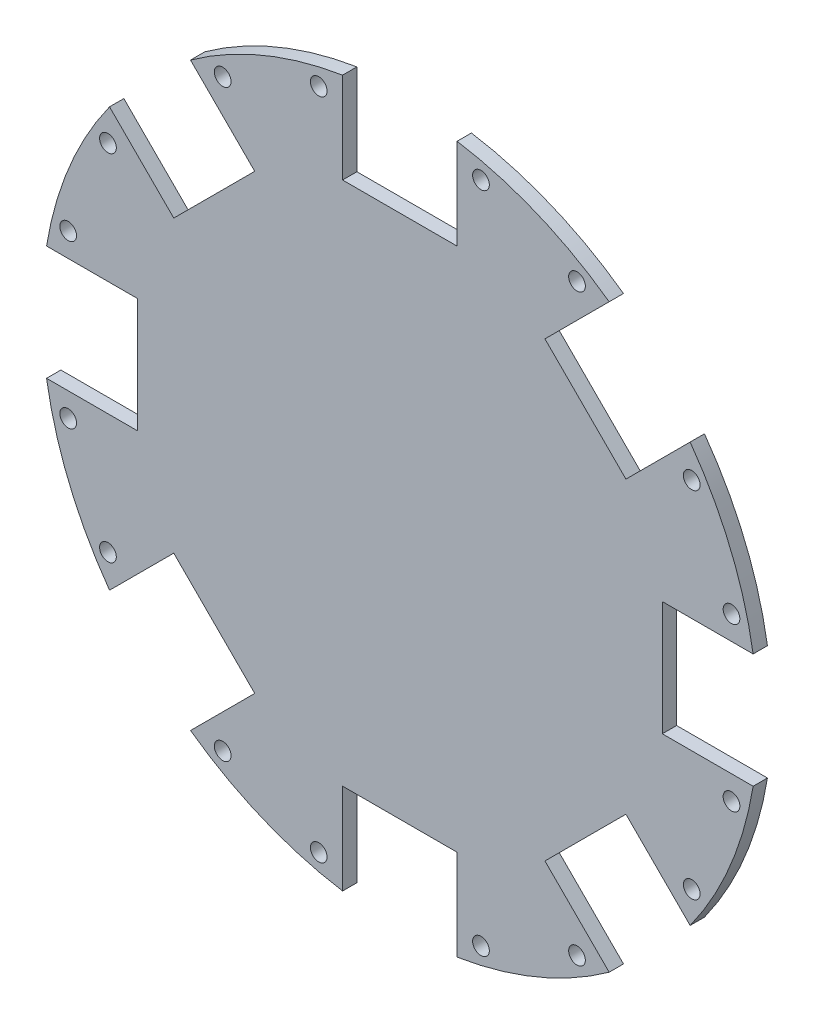
from build123d import *

# Parameters (mm, degrees)
SKETCH1_R           = 1.75
BOSS_EXTRUDE2_DEPTH = 3


with BuildPart() as part:
    # Sketch1 → Boss-Extrude2 (new body)
    with BuildSketch(Plane.XY):
        with BuildLine():
            Line((12, 55), (0, 55))
            Line((0, 55), (-12, 55))
            Line((-12, 55), (-12, 69.5))
            Line((-12, 69.5), (-12, 74.033776076))
            ThreePointArc((-12, 74.033776076), (-28.701257427, 69.290964938), (-43.864503726, 60.835066474))
            Line((-43.864503726, 60.835066474), (-30.405591591, 47.376154339))
            Line((-30.405591591, 47.376154339), (-47.376154339, 30.405591591))
            Line((-47.376154339, 30.405591591), (-60.835066474, 43.864503726))
            ThreePointArc((-60.835066474, 43.864503726), (-69.290964938, 28.701257427), (-74.033776076, 12))
            Line((-74.033776076, 12), (-55, 12))
            Line((-55, 12), (-55, -12))
            Line((-55, -12), (-74.033776076, -12))
            ThreePointArc((-74.033776076, -12), (-69.290964938, -28.701257427), (-60.835066474, -43.864503726))
            Line((-60.835066474, -43.864503726), (-47.376154339, -30.405591591))
            Line((-47.376154339, -30.405591591), (-30.405591591, -47.376154339))
            Line((-30.405591591, -47.376154339), (-43.864503726, -60.835066474))
            ThreePointArc((-43.864503726, -60.835066474), (-28.701257427, -69.290964938), (-12, -74.033776076))
            Line((-12, -74.033776076), (-12, -55))
            Line((-12, -55), (12, -55))
            Line((12, -55), (12, -74.033776076))
            ThreePointArc((12, -74.033776076), (28.701257427, -69.290964938), (43.864503726, -60.835066474))
            Line((43.864503726, -60.835066474), (30.405591591, -47.376154339))
            Line((30.405591591, -47.376154339), (47.37615434, -30.405591591))
            Line((47.37615434, -30.405591591), (60.835066474, -43.864503726))
            ThreePointArc((60.835066474, -43.864503726), (69.290964938, -28.701257427), (74.033776076, -12))
            Line((74.033776076, -12), (55, -12))
            Line((55, -12), (55, 12))
            Line((55, 12), (74.033776076, 12))
            ThreePointArc((74.033776076, 12), (69.290964938, 28.701257427), (60.835066474, 43.864503726))
            Line((60.835066474, 43.864503726), (47.376154339, 30.405591591))
            Line((47.376154339, 30.405591591), (30.405591591, 47.37615434))
            Line((30.405591591, 47.37615434), (43.864503726, 60.835066474))
            ThreePointArc((43.864503726, 60.835066474), (28.701257427, 69.290964938), (12, 74.033776076))
            Line((12, 74.033776076), (12, 69.5))
            Line((12, 69.5), (12, 55))
        make_face()
        with Locations((-37.123106012, -61.164736573)):
            Circle(SKETCH1_R, mode=Mode.SUBTRACT)
        with Locations((-17, -69.5)):
            Circle(SKETCH1_R, mode=Mode.SUBTRACT)
        with Locations((-61.164736573, -37.123106012)):
            Circle(SKETCH1_R, mode=Mode.SUBTRACT)
        with Locations((-69.5, -17)):
            Circle(SKETCH1_R, mode=Mode.SUBTRACT)
        with Locations((17, -69.5)):
            Circle(SKETCH1_R, mode=Mode.SUBTRACT)
        with Locations((37.123106012, -61.164736573)):
            Circle(SKETCH1_R, mode=Mode.SUBTRACT)
        with Locations((61.164736573, -37.123106012)):
            Circle(SKETCH1_R, mode=Mode.SUBTRACT)
        with Locations((69.5, -17)):
            Circle(SKETCH1_R, mode=Mode.SUBTRACT)
        with Locations((-69.5, 17)):
            Circle(SKETCH1_R, mode=Mode.SUBTRACT)
        with Locations((-61.164736573, 37.123106012)):
            Circle(SKETCH1_R, mode=Mode.SUBTRACT)
        with Locations((-37.123106012, 61.164736573)):
            Circle(SKETCH1_R, mode=Mode.SUBTRACT)
        with Locations((-17, 69.5)):
            Circle(SKETCH1_R, mode=Mode.SUBTRACT)
        with Locations((69.5, 17)):
            Circle(SKETCH1_R, mode=Mode.SUBTRACT)
        with Locations((61.164736573, 37.123106012)):
            Circle(SKETCH1_R, mode=Mode.SUBTRACT)
        with BuildLine():
            ThreePointArc((18.75, 69.5), (17, 67.75), (15.25, 69.5))
            ThreePointArc((15.25, 69.5), (17, 71.25), (18.75, 69.5))
        make_face(mode=Mode.SUBTRACT)
        with Locations((37.123106012, 61.164736573)):
            Circle(SKETCH1_R, mode=Mode.SUBTRACT)
    extrude(amount=BOSS_EXTRUDE2_DEPTH)


solid = part.part
